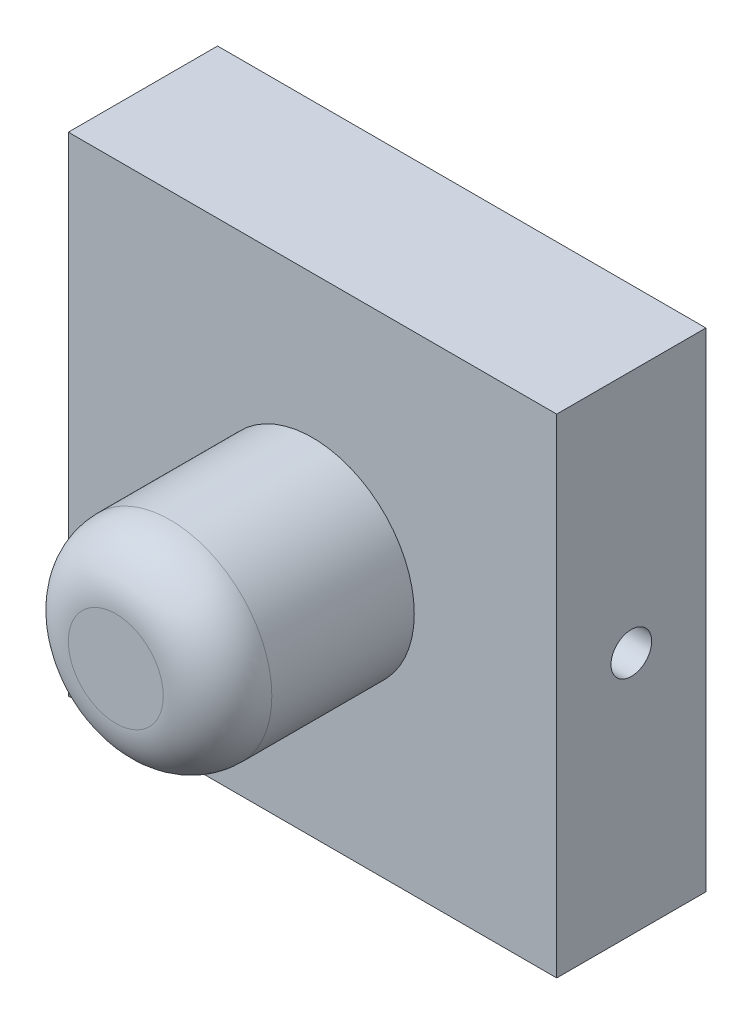
from build123d import *

# Parameters (mm, degrees)
SKETCH_1_W          = 11
SKETCH_1_H          = 36
EXTRUDE_1_DEPTH     = 18
SKETCH_2_R          = 7.5
EXTRUDE_2_DEPTH     = 20
FILLET_3_R          = 4
SKETCH_3_R          = 1.5
CUT_EXTRUDE_1_DEPTH = 45.944410108


with BuildPart() as part:
    # 草图1 → 凸台-拉伸1 (new, symmetric)
    with BuildSketch(Plane(origin=(0, 0, 0), x_dir=(0, 0, -1), z_dir=(1, 0, 0))):
        Rectangle(SKETCH_1_W, SKETCH_1_H)
    extrude(amount=EXTRUDE_1_DEPTH, both=True)

    # 草图2 → 凸台-拉伸2 (add)
    with BuildSketch(Plane.XY):
        with Locations(Location((0, 0, 0), (0, 0, 180))):
            Circle(SKETCH_2_R)
    extrude(amount=EXTRUDE_2_DEPTH)

    # 圆角3
    fillet_3_edges = [part.edges().sort_by_distance(p)[0] for p in [
        (7.5, 0, 20),
    ]]
    fillet(fillet_3_edges, radius=FILLET_3_R)

    # 草图3 → 切除-拉伸1 (cut, through all)
    with BuildSketch(Plane.ZY.offset(18)):
        Circle(SKETCH_3_R)
    extrude(amount=-CUT_EXTRUDE_1_DEPTH, mode=Mode.SUBTRACT)


solid = part.part
